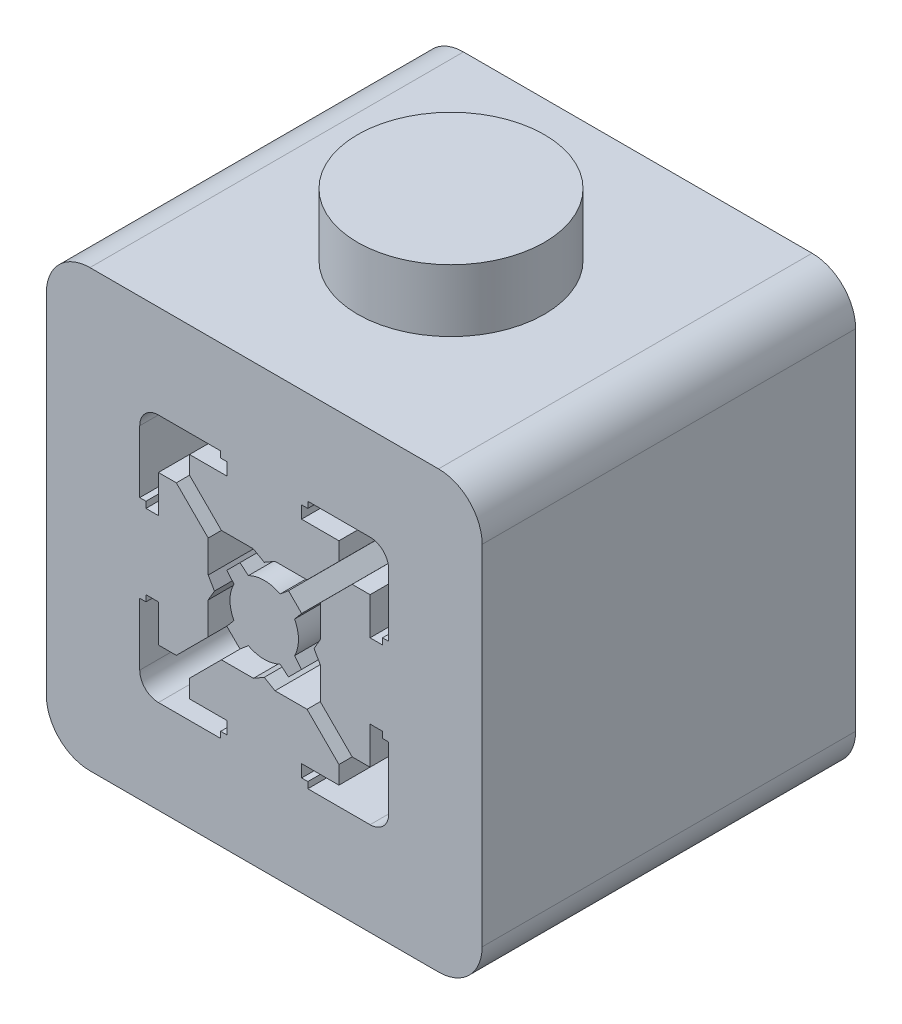
from build123d import *

# Parameters (mm, degrees)
BOSS_EXTRU_1_DEPTH      = 30
BOSS_EXTRU_5_DEPTH      = 30
ESQUISSE3_R             = 7.5
BOSS_EXTRU_2_DEPTH      = 5
BOSS_EXTRU_8_DEPTH      = 5
BOSS_EXTRU_8_DEPTH_BACK = 5


with BuildPart() as part:
    # Esquisse1 → Boss.-Extru.1 (new body)
    with BuildSketch(Plane.XY):
        with BuildLine():
            Line((-14, 17.5), (14, 17.5))
            ThreePointArc((14, 17.5), (16.474873734, 16.474873734), (17.5, 14))
            Line((17.5, 14), (17.5, -14))
            ThreePointArc((17.5, -14), (16.474873734, -16.474873734), (14, -17.5))
            Line((14, -17.5), (-14, -17.5))
            ThreePointArc((-14, -17.5), (-16.474873734, -16.474873734), (-17.5, -14))
            Line((-17.5, -14), (-17.5, 14))
            ThreePointArc((-17.5, 14), (-16.474873734, 16.474873734), (-14, 17.5))
        make_face()
        with BuildLine():
            Line((-4, 0), (-4.5, 0.866025404))
            Line((-4.5, 0.866025404), (-4.5, 3.439339828))
            Line((-4.5, 3.439339828), (-7.060660172, 6))
            Line((-7.060660172, 6), (-8.5, 6))
            Line((-8.5, 6), (-8.5, 3))
            Line((-8.5, 3), (-9.5, 3))
            Line((-9.5, 3), (-9.5, 3.5))
            Line((-9.5, 3.5), (-10, 3.5))
            Line((-10, 3.5), (-10, 8.5))
            ThreePointArc((-10, 8.5), (-9.560660172, 9.560660172), (-8.5, 10))
            Line((-8.5, 10), (-3.5, 10))
            Line((-3.5, 10), (-3.5, 9.5))
            Line((-3.5, 9.5), (-3, 9.5))
            Line((-3, 9.5), (-3, 8.5))
            Line((-3, 8.5), (-6, 8.5))
            Line((-6, 8.5), (-6, 7.060660172))
            Line((-6, 7.060660172), (-3.439339828, 4.5))
            Line((-3.439339828, 4.5), (-0.866025404, 4.5))
            Line((-0.866025404, 4.5), (0, 4))
            Line((0, 4), (0.866025404, 4.5))
            Line((0.866025404, 4.5), (3.439339828, 4.5))
            Line((3.439339828, 4.5), (6, 7.060660172))
            Line((6, 7.060660172), (6, 8.5))
            Line((6, 8.5), (3, 8.5))
            Line((3, 8.5), (3, 9.5))
            Line((3, 9.5), (3.5, 9.5))
            Line((3.5, 9.5), (3.5, 10))
            Line((3.5, 10), (8.5, 10))
            ThreePointArc((8.5, 10), (9.560660172, 9.560660172), (10, 8.5))
            Line((10, 8.5), (10, 3.5))
            Line((10, 3.5), (9.5, 3.5))
            Line((9.5, 3.5), (9.5, 3))
            Line((9.5, 3), (8.5, 3))
            Line((8.5, 3), (8.5, 6))
            Line((8.5, 6), (7.060660172, 6))
            Line((7.060660172, 6), (4.5, 3.439339828))
            Line((4.5, 3.439339828), (4.5, 0.866025404))
            Line((4.5, 0.866025404), (4, 0))
            Line((4, 0), (4.5, -0.866025404))
            Line((4.5, -0.866025404), (4.5, -3.439339828))
            Line((4.5, -3.439339828), (7.060660172, -6))
            Line((7.060660172, -6), (8.5, -6))
            Line((8.5, -6), (8.5, -3))
            Line((8.5, -3), (9.5, -3))
            Line((9.5, -3), (9.5, -3.5))
            Line((9.5, -3.5), (10, -3.5))
            Line((10, -3.5), (10, -8.5))
            ThreePointArc((10, -8.5), (9.560660172, -9.560660172), (8.5, -10))
            Line((8.5, -10), (3.5, -10))
            Line((3.5, -10), (3.5, -9.5))
            Line((3.5, -9.5), (3, -9.5))
            Line((3, -9.5), (3, -8.5))
            Line((3, -8.5), (6, -8.5))
            Line((6, -8.5), (6, -7.060660172))
            Line((6, -7.060660172), (3.439339828, -4.5))
            Line((3.439339828, -4.5), (0.866025404, -4.5))
            Line((0.866025404, -4.5), (0, -4))
            Line((0, -4), (-0.866025404, -4.5))
            Line((-0.866025404, -4.5), (-3.439339828, -4.5))
            Line((-3.439339828, -4.5), (-6, -7.060660172))
            Line((-6, -7.060660172), (-6, -8.5))
            Line((-6, -8.5), (-3, -8.5))
            Line((-3, -8.5), (-3, -9.5))
            Line((-3, -9.5), (-3.5, -9.5))
            Line((-3.5, -9.5), (-3.5, -10))
            Line((-3.5, -10), (-8.5, -10))
            ThreePointArc((-8.5, -10), (-9.560660172, -9.560660172), (-10, -8.5))
            Line((-10, -8.5), (-10, -3.5))
            Line((-10, -3.5), (-9.5, -3.5))
            Line((-9.5, -3.5), (-9.5, -3))
            Line((-9.5, -3), (-8.5, -3))
            Line((-8.5, -3), (-8.5, -6))
            Line((-8.5, -6), (-7.060660172, -6))
            Line((-7.060660172, -6), (-4.5, -3.439339828))
            Line((-4.5, -3.439339828), (-4.5, -0.866025404))
            Line((-4.5, -0.866025404), (-4, 0))
        make_face(mode=Mode.SUBTRACT)
    extrude(amount=BOSS_EXTRU_1_DEPTH)

    # Esquisse3 → Boss.-Extru.2 (add)
    with BuildSketch(Plane(origin=(0, 17.5, 0), x_dir=(1, 0, 0), z_dir=(0, 1, 0))):
        with Locations((0, -15)):
            Circle(ESQUISSE3_R)
    extrude(amount=BOSS_EXTRU_2_DEPTH)



with BuildPart() as body_2:
    # Esquisse1<5> → Boss.-Extru.5 (new body)
    with BuildSketch(Plane.XY):
        with BuildLine():
            Line((3.003181207, 1.947287092), (1.949592103, 3.000876196))
            Line((1.949592103, 3.000876196), (1.276279893, 2.435900169))
            ThreePointArc((1.276279893, 2.435900169), (0.001756003, 2.749999439), (-1.273167982, 2.43752811))
            Line((-1.273167982, 2.43752811), (-1.947287092, 3.003181207))
            Line((-1.947287092, 3.003181207), (-3.000876196, 1.949592103))
            Line((-3.000876196, 1.949592103), (-2.435900169, 1.276279893))
            ThreePointArc((-2.435900169, 1.276279893), (-2.749999439, 0.001756003), (-2.43752811, -1.273167982))
            Line((-2.43752811, -1.273167982), (-3.003181207, -1.947287092))
            Line((-3.003181207, -1.947287092), (-1.949592103, -3.000876196))
            Line((-1.949592103, -3.000876196), (-1.276279893, -2.435900169))
            ThreePointArc((-1.276279893, -2.435900169), (-0.001756003, -2.749999439), (1.273167982, -2.43752811))
            Line((1.273167982, -2.43752811), (1.947287092, -3.003181207))
            Line((1.947287092, -3.003181207), (3.000876196, -1.949592103))
            Line((3.000876196, -1.949592103), (2.435900169, -1.276279893))
            ThreePointArc((2.435900169, -1.276279893), (2.749999439, -0.001756003), (2.43752811, 1.273167982))
            Line((2.43752811, 1.273167982), (3.003181207, 1.947287092))
        make_face()
    extrude(amount=BOSS_EXTRU_5_DEPTH)


with BuildPart() as part_1:
    add(part.part)

    add(body_2.part)  # Boss.-Extru.8 merges body 2
    # Esquisse14 → Boss.-Extru.8 (add, two sides: drawn at the far end of the back side and taken through both)
    with BuildSketch(Plane.XY.offset(15).offset(-BOSS_EXTRU_8_DEPTH_BACK)):
        with BuildLine():
            Line((-4, 0), (-4.5, 0.866025404))
            Line((-4.5, 0.866025404), (-4.5, 3.439339828))
            Line((-4.5, 3.439339828), (-7.060660172, 6))
            Line((-7.060660172, 6), (-8.5, 6))
            Line((-8.5, 6), (-8.5, 3))
            Line((-8.5, 3), (-9.5, 3))
            Line((-9.5, 3), (-9.5, 3.5))
            Line((-9.5, 3.5), (-10, 3.5))
            Line((-10, 3.5), (-10, 8.5))
            ThreePointArc((-10, 8.5), (-9.560660172, 9.560660172), (-8.5, 10))
            Line((-8.5, 10), (-3.5, 10))
            Line((-3.5, 10), (-3.5, 9.5))
            Line((-3.5, 9.5), (-3, 9.5))
            Line((-3, 9.5), (-3, 8.5))
            Line((-3, 8.5), (-6, 8.5))
            Line((-6, 8.5), (-6, 7.060660172))
            Line((-6, 7.060660172), (-3.439339828, 4.5))
            Line((-3.439339828, 4.5), (-0.866025404, 4.5))
            Line((-0.866025404, 4.5), (0, 4))
            Line((0, 4), (0.866025404, 4.5))
            Line((0.866025404, 4.5), (3.439339828, 4.5))
            Line((3.439339828, 4.5), (6, 7.060660172))
            Line((6, 7.060660172), (6, 8.5))
            Line((6, 8.5), (3, 8.5))
            Line((3, 8.5), (3, 9.5))
            Line((3, 9.5), (3.5, 9.5))
            Line((3.5, 9.5), (3.5, 10))
            Line((3.5, 10), (8.5, 10))
            ThreePointArc((8.5, 10), (9.560660172, 9.560660172), (10, 8.5))
            Line((10, 8.5), (10, 3.5))
            Line((10, 3.5), (9.5, 3.5))
            Line((9.5, 3.5), (9.5, 3))
            Line((9.5, 3), (8.5, 3))
            Line((8.5, 3), (8.5, 6))
            Line((8.5, 6), (7.060660172, 6))
            Line((7.060660172, 6), (4.5, 3.439339828))
            Line((4.5, 3.439339828), (4.5, 0.866025404))
            Line((4.5, 0.866025404), (4, 0))
            Line((4, 0), (4.5, -0.866025404))
            Line((4.5, -0.866025404), (4.5, -3.439339828))
            Line((4.5, -3.439339828), (7.060660172, -6))
            Line((7.060660172, -6), (8.5, -6))
            Line((8.5, -6), (8.5, -3))
            Line((8.5, -3), (9.5, -3))
            Line((9.5, -3), (9.5, -3.5))
            Line((9.5, -3.5), (10, -3.5))
            Line((10, -3.5), (10, -8.5))
            ThreePointArc((10, -8.5), (9.560660172, -9.560660172), (8.5, -10))
            Line((8.5, -10), (3.5, -10))
            Line((3.5, -10), (3.5, -9.5))
            Line((3.5, -9.5), (3, -9.5))
            Line((3, -9.5), (3, -8.5))
            Line((3, -8.5), (6, -8.5))
            Line((6, -8.5), (6, -7.060660172))
            Line((6, -7.060660172), (3.439339828, -4.5))
            Line((3.439339828, -4.5), (0.866025404, -4.5))
            Line((0.866025404, -4.5), (0, -4))
            Line((0, -4), (-0.866025404, -4.5))
            Line((-0.866025404, -4.5), (-3.439339828, -4.5))
            Line((-3.439339828, -4.5), (-6, -7.060660172))
            Line((-6, -7.060660172), (-6, -8.5))
            Line((-6, -8.5), (-3, -8.5))
            Line((-3, -8.5), (-3, -9.5))
            Line((-3, -9.5), (-3.5, -9.5))
            Line((-3.5, -9.5), (-3.5, -10))
            Line((-3.5, -10), (-8.5, -10))
            ThreePointArc((-8.5, -10), (-9.560660172, -9.560660172), (-10, -8.5))
            Line((-10, -8.5), (-10, -3.5))
            Line((-10, -3.5), (-9.5, -3.5))
            Line((-9.5, -3.5), (-9.5, -3))
            Line((-9.5, -3), (-8.5, -3))
            Line((-8.5, -3), (-8.5, -6))
            Line((-8.5, -6), (-7.060660172, -6))
            Line((-7.060660172, -6), (-4.5, -3.439339828))
            Line((-4.5, -3.439339828), (-4.5, -0.866025404))
            Line((-4.5, -0.866025404), (-4, 0))
        make_face()
    extrude(amount=BOSS_EXTRU_8_DEPTH + BOSS_EXTRU_8_DEPTH_BACK)


solid = part_1.part
